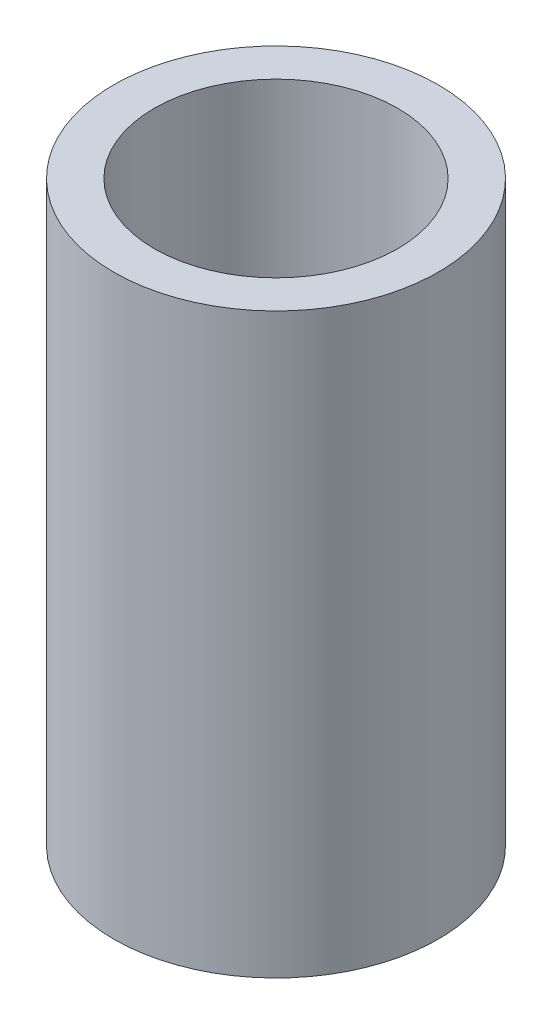
from build123d import *

# Parameters (mm, degrees)
SKETCH1_R           = 8
SKETCH1_R_2         = 6
BOSS_EXTRUDE1_DEPTH = 28.477000044


with BuildPart() as part:
    # Sketch1 → Boss-Extrude1 (new body)
    with BuildSketch(Plane(origin=(0, 0, 0), x_dir=(1, 0, 0), z_dir=(0, 1, 0))):
        with Locations(Location((0, 0, 0), (0, 0, 270))):
            Circle(SKETCH1_R)
        with Locations(Location((0, 0, 0), (0, 0, 270))):
            Circle(SKETCH1_R_2, mode=Mode.SUBTRACT)
    extrude(amount=BOSS_EXTRUDE1_DEPTH)


solid = part.part
